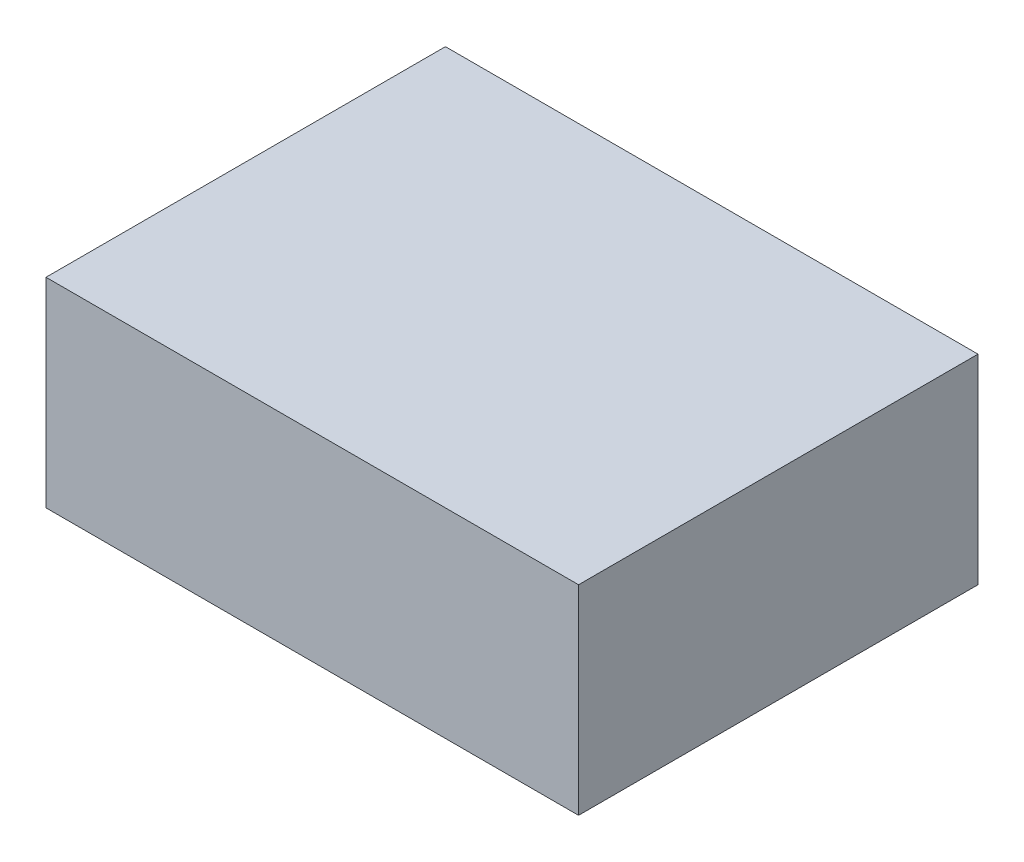
from build123d import *

# Parameters (mm, degrees)
SKETCH1_W           = 101.6
SKETCH1_H           = 76.2
BOSS_EXTRUDE1_DEPTH = 38.1


with BuildPart() as part:
    # Sketch1 → Boss-Extrude1 (new body)
    with BuildSketch(Plane(origin=(0, 0, 0), x_dir=(1, 0, 0), z_dir=(0, 1, 0))):
        Rectangle(SKETCH1_W, SKETCH1_H)
    extrude(amount=BOSS_EXTRUDE1_DEPTH)


solid = part.part
